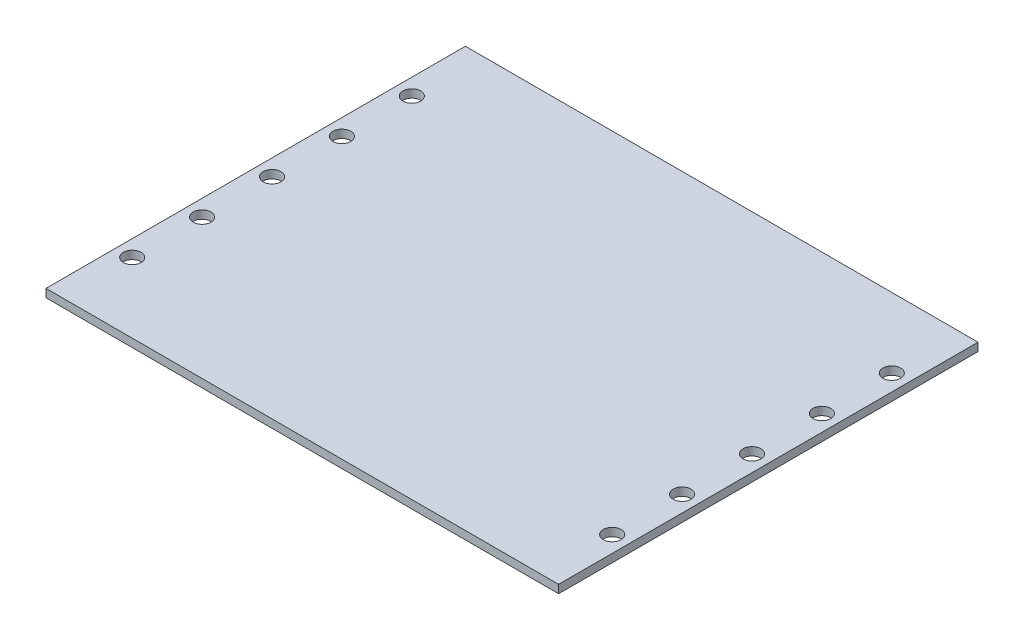
from build123d import *

# Parameters (mm, degrees)
SKETCH1_W          = 110
SKETCH1_H          = 90
FR4_DEPTH          = 1.7526
SKETCH7_R          = 1.905
CUT_EXTRUDE1_DEPTH = 143.1375095


with BuildPart() as part:
    # Sketch1 → FR4 (new body)
    with BuildSketch(Plane(origin=(0, 0, 0), x_dir=(1, 0, 0), z_dir=(0, 1, 0))):
        with Locations((55, 45)):
            Rectangle(SKETCH1_W, SKETCH1_H)
    extrude(amount=FR4_DEPTH)

    # Sketch7 → Cut-Extrude1 (cut, through all)
    with BuildSketch(Plane(origin=(0, 1.7526, 0), x_dir=(1, 0, 0), z_dir=(0, 1, 0))):
        with Locations(Location((3.5, 15, 0), (0, 0, 270))):
            Circle(SKETCH7_R)
        with Locations(Location((106.5, 15, 0), (0, 0, 270))):
            Circle(SKETCH7_R)
        with Locations(Location((106.5, 30, 0), (0, 0, 270))):
            Circle(SKETCH7_R)
        with Locations(Location((106.5, 45, 0), (0, 0, 270))):
            Circle(SKETCH7_R)
        with Locations(Location((106.5, 60, 0), (0, 0, 270))):
            Circle(SKETCH7_R)
        with Locations(Location((106.5, 75, 0), (0, 0, 270))):
            Circle(SKETCH7_R)
        with Locations(Location((3.5, 30, 0), (0, 0, 270))):
            Circle(SKETCH7_R)
        with Locations(Location((3.5, 45, 0), (0, 0, 270))):
            Circle(SKETCH7_R)
        with Locations(Location((3.5, 60, 0), (0, 0, 270))):
            Circle(SKETCH7_R)
        with Locations(Location((3.5, 75, 0), (0, 0, 270))):
            Circle(SKETCH7_R)
    extrude(amount=-CUT_EXTRUDE1_DEPTH, mode=Mode.SUBTRACT)


solid = part.part
